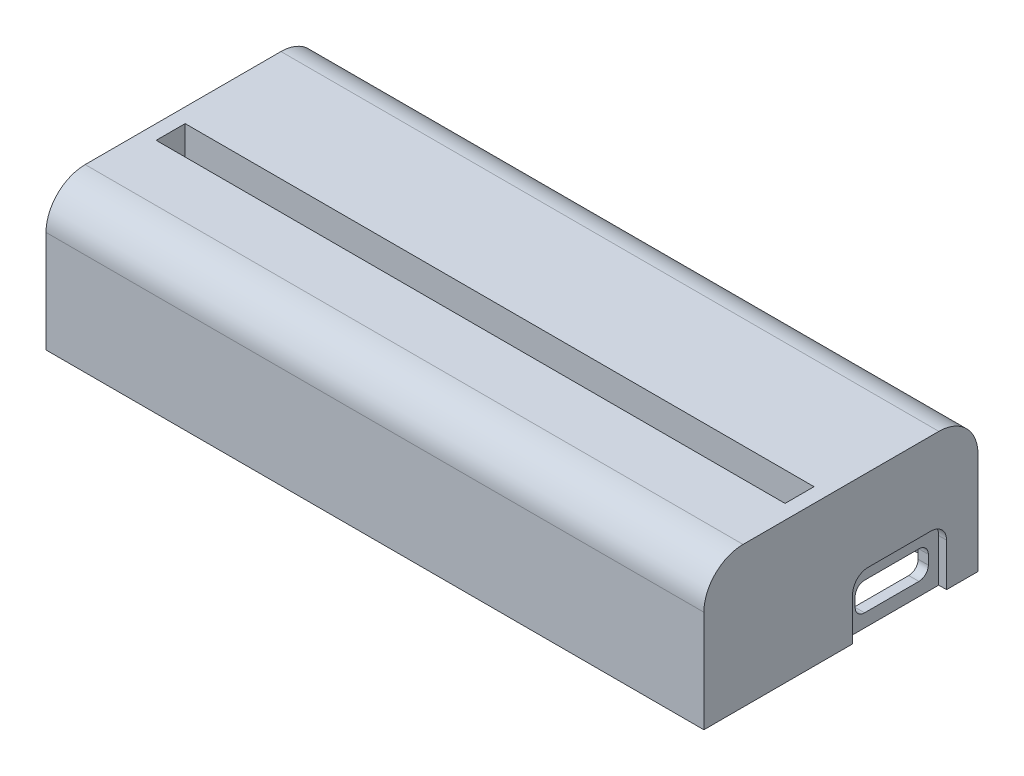
from build123d import *

# Parameters (mm, degrees)
SKETCH1_W           = 68
SKETCH1_H           = 35
BOSS_EXTRUDE1_DEPTH = 18
CUT_EXTRUDE1_DEPTH  = 5.28
SKETCH4_W           = 57.55
SKETCH4_H           = 1.8
BOSS_EXTRUDE2_DEPTH = 3.46
SKETCH5_R           = 2.5
CUT_EXTRUDE2_DEPTH  = 6
SKETCH6_W           = 35
SKETCH6_H           = 18
BOSS_EXTRUDE3_DEPTH = 16
CUT_EXTRUDE3_DEPTH  = 3
SKETCH9_W           = 80.3
SKETCH9_H           = 3.7
CUT_EXTRUDE4_DEPTH  = 20
SKETCH10_W          = 12
SKETCH10_H          = 8
CUT_EXTRUDE5_DEPTH  = 1
FILLET1_R           = 2
FILLET2_R           = 5


with BuildPart() as part:
    # Sketch1 → Boss-Extrude1 (new body)
    with BuildSketch(Plane(origin=(0, 0, 0), x_dir=(1, 0, 0), z_dir=(0, 1, 0))):
        Rectangle(SKETCH1_W, SKETCH1_H)
    extrude(amount=BOSS_EXTRUDE1_DEPTH)

    # Sketch3 → Cut-Extrude1 (cut)
    with BuildSketch(Plane.XZ):
        Polygon((31.7, -15.7), (31.7, 12.64), (-25.85, 12.64), (-25.85, 7.67), (-32.09, 7.67), (-32.09, -10.73), (-25.85, -10.73), (-25.85, -15.7), align=None)
    extrude(amount=-CUT_EXTRUDE1_DEPTH, mode=Mode.SUBTRACT)

    # Sketch4 → Boss-Extrude2 (add)
    with BuildSketch(Plane.XZ.offset(-5.28)):
        with Locations((2.925, 11.74)):
            Rectangle(SKETCH4_W, SKETCH4_H)
        with Locations((2.925, -14.8)):
            Rectangle(SKETCH4_W, SKETCH4_H)
    extrude(amount=BOSS_EXTRUDE2_DEPTH)

    # Sketch5 → Cut-Extrude2 (cut)
    with BuildSketch(Plane.XZ):
        with Locations(Location((29.5, 14.5, 0), (0, 0, 270))):
            Circle(SKETCH5_R)
        with Locations(Location((-30.5, -14, 0), (0, 0, 270))):
            Circle(SKETCH5_R)
    extrude(amount=-CUT_EXTRUDE2_DEPTH, mode=Mode.SUBTRACT)

    # Sketch6 → Boss-Extrude3 (add)
    with BuildSketch(Plane.ZY.offset(34)):
        with Locations((0, 9)):
            Rectangle(SKETCH6_W, SKETCH6_H)
    extrude(amount=BOSS_EXTRUDE3_DEPTH)

    # Sketch8 → Cut-Extrude3 (cut)
    with BuildSketch(Plane(origin=(34, 0, 0), x_dir=(0, 0, -1), z_dir=(1, 0, 0))):
        with BuildLine():
            Line((2.816168173, 4.079999973), (2.816168173, 2.879999987))
            ThreePointArc((2.816168173, 2.879999987), (3.167640032, 2.031471858), (4.016168161, 1.679999999))
            Line((4.016168161, 1.679999999), (10.956168078, 1.679999999))
            ThreePointArc((10.956168078, 1.679999999), (11.804696206, 2.031471858), (12.156168065, 2.879999987))
            Line((12.156168065, 2.879999987), (12.156168065, 4.079999973))
            ThreePointArc((12.156168065, 4.079999973), (11.804696206, 4.928528102), (10.956168078, 5.279999961))
            Line((10.956168078, 5.279999961), (4.016168161, 5.279999961))
            ThreePointArc((4.016168161, 5.279999961), (3.167640032, 4.928528102), (2.816168173, 4.079999973))
        make_face()
    extrude(amount=-CUT_EXTRUDE3_DEPTH, mode=Mode.SUBTRACT)

    # Sketch9 → Cut-Extrude4 (cut)
    with BuildSketch(Plane(origin=(0, 18, 0), x_dir=(1, 0, 0), z_dir=(0, 1, 0))):
        with Locations((-8, -3.4346612)):
            Rectangle(SKETCH9_W, SKETCH9_H)
    extrude(amount=-CUT_EXTRUDE4_DEPTH, mode=Mode.SUBTRACT)

    # Sketch10 → Cut-Extrude5 (cut)
    with BuildSketch(Plane(origin=(34, 0, 0), x_dir=(0, 0, -1), z_dir=(1, 0, 0))):
        with Locations((7.486168119, 3.47999998)):
            Rectangle(SKETCH10_W, SKETCH10_H)
    extrude(amount=-CUT_EXTRUDE5_DEPTH, mode=Mode.SUBTRACT)

    # Fillet1
    fillet1_edges = [part.edges().sort_by_distance(p)[0] for p in [
        (33.5, 7.47999998, -13.486168119),
        (33.5, 7.47999998, -1.486168119),
    ]]
    fillet(fillet1_edges, radius=FILLET1_R)

    # Fillet2
    fillet2_edges = [part.edges().sort_by_distance(p)[0] for p in [
        (-8, 18, 17.5),
        (-8, 18, -17.5),
    ]]
    fillet(fillet2_edges, radius=FILLET2_R)


solid = part.part
